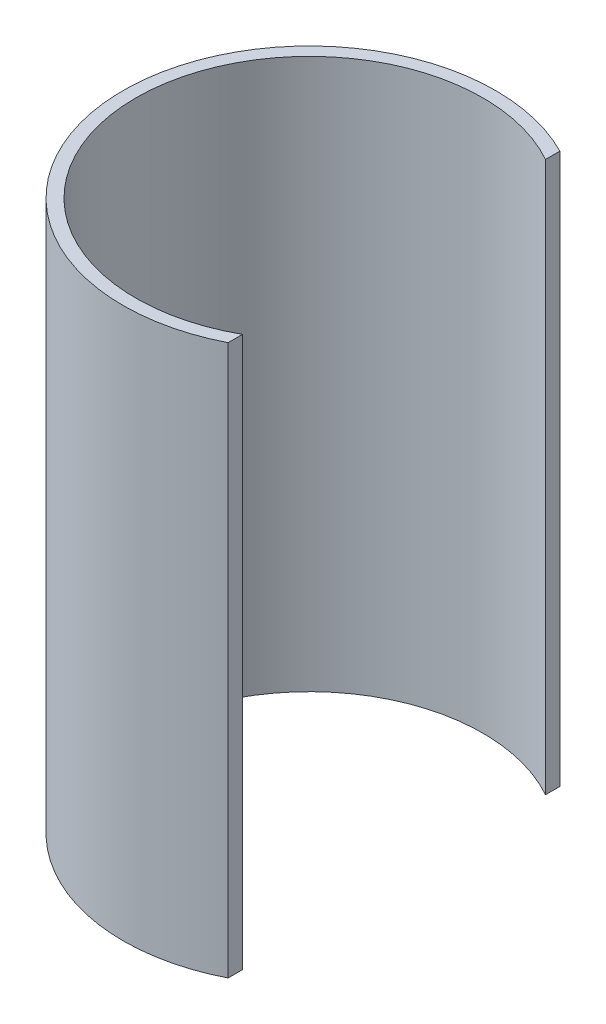
from build123d import *

# Parameters (mm, degrees)
SKETCH_1_W               = 3
SKETCH_1_H               = 130
CUT_EXTRUDE_1_DEPTH      = 145.124945794
CUT_EXTRUDE_1_DEPTH_BACK = 145.124945794
SKETCH_2_W               = 35
SKETCH_2_H               = 130


with BuildPart() as part:
    # 草图1 → 旋转1 (revolve)
    with BuildSketch(Plane.XY, mode=Mode.PRIVATE) as revolve_1_sk:
        with Locations((42.5, 65)):
            Rectangle(SKETCH_1_W, SKETCH_1_H)
    revolve(revolve_1_sk.sketch.rotate(Axis((0, 76.141528545, 0), (0, -1, 0)), 90), axis=Axis((0, 76.141528545, 0), (0, -1, 0)))

    # 草图2 → 切除-拉伸1 (cut, two sides: drawn at the far end of the back side and taken through both)
    with BuildSketch(Plane.XY.offset(-CUT_EXTRUDE_1_DEPTH_BACK)):
        with Locations((37.5, 65)):
            Rectangle(SKETCH_2_W, SKETCH_2_H)
    extrude(amount=CUT_EXTRUDE_1_DEPTH + CUT_EXTRUDE_1_DEPTH_BACK, mode=Mode.SUBTRACT)


solid = part.part
